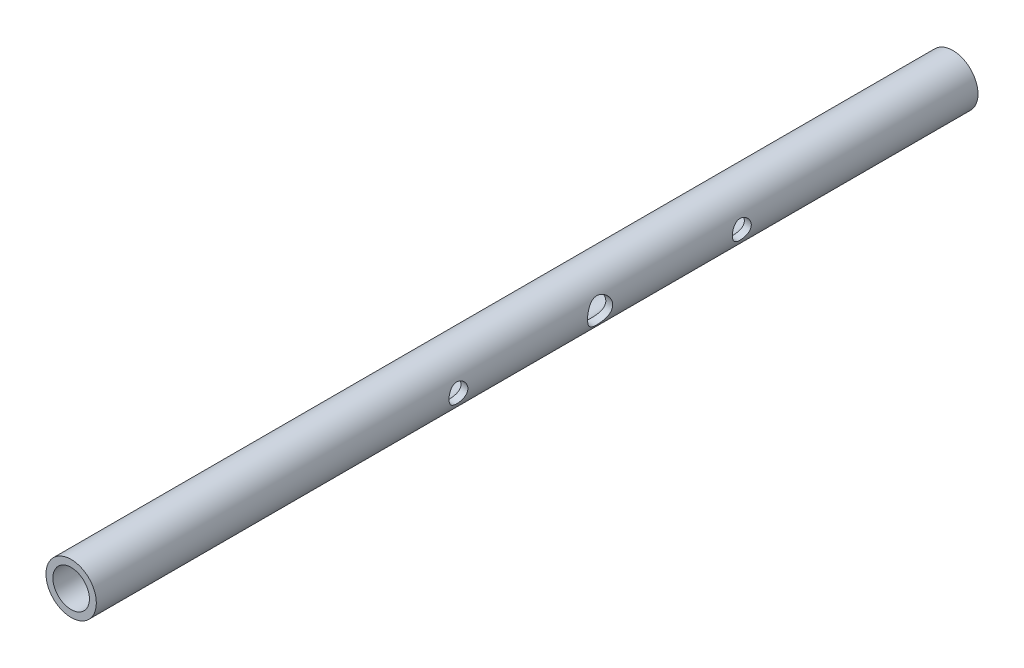
from build123d import *

# Parameters (mm, degrees)
SKETCH1_R                                  = 4
SKETCH1_R_2                                = 2.9
SHAFT_BOSS_EXTRUDE1_DEPTH                  = 140
PCB_MOUNTINGHOPLES_CUT_EXTRUDE1_DEPTH      = 8.232243507
PCB_MOUNTINGHOPLES_CUT_EXTRUDE1_DEPTH_BACK = 16
SKETCH2_R                                  = 1.5
SKETCH3_R                                  = 2
PCB_CONNECTOR_HOLE_CUT_EXTRUDE2_DEPTH      = 10


with BuildPart() as part:
    # Sketch1 → Shaft Boss-Extrude1 (new body)
    with BuildSketch(Plane.XY):
        Circle(SKETCH1_R)
        Circle(SKETCH1_R_2, mode=Mode.SUBTRACT)
    extrude(amount=SHAFT_BOSS_EXTRUDE1_DEPTH)

    # Sketch2 → PCB Mountinghoples Cut-Extrude1 (cut, two sides: drawn at the far end of the back side and taken through both)
    with BuildSketch(Plane(origin=(0, 0, 0), x_dir=(0, 0, -1), z_dir=(1, 0, 0)).offset(-PCB_MOUNTINGHOPLES_CUT_EXTRUDE1_DEPTH_BACK)):
        with Locations((-82.5, 0)):
            Circle(SKETCH2_R)
        with Locations((-37.5, 0)):
            Circle(SKETCH2_R)
    extrude(amount=PCB_MOUNTINGHOPLES_CUT_EXTRUDE1_DEPTH + PCB_MOUNTINGHOPLES_CUT_EXTRUDE1_DEPTH_BACK, mode=Mode.SUBTRACT)

    # Sketch3 → PCB COnnector Hole Cut-Extrude2 (cut)
    with BuildSketch(Plane(origin=(0, 0, 0), x_dir=(0, 0, -1), z_dir=(1, 0, 0))):
        with Locations(Location((-60, 0, 0), (0, 0, 180))):
            Circle(SKETCH3_R)
    extrude(amount=PCB_CONNECTOR_HOLE_CUT_EXTRUDE2_DEPTH, mode=Mode.SUBTRACT)


solid = part.part
